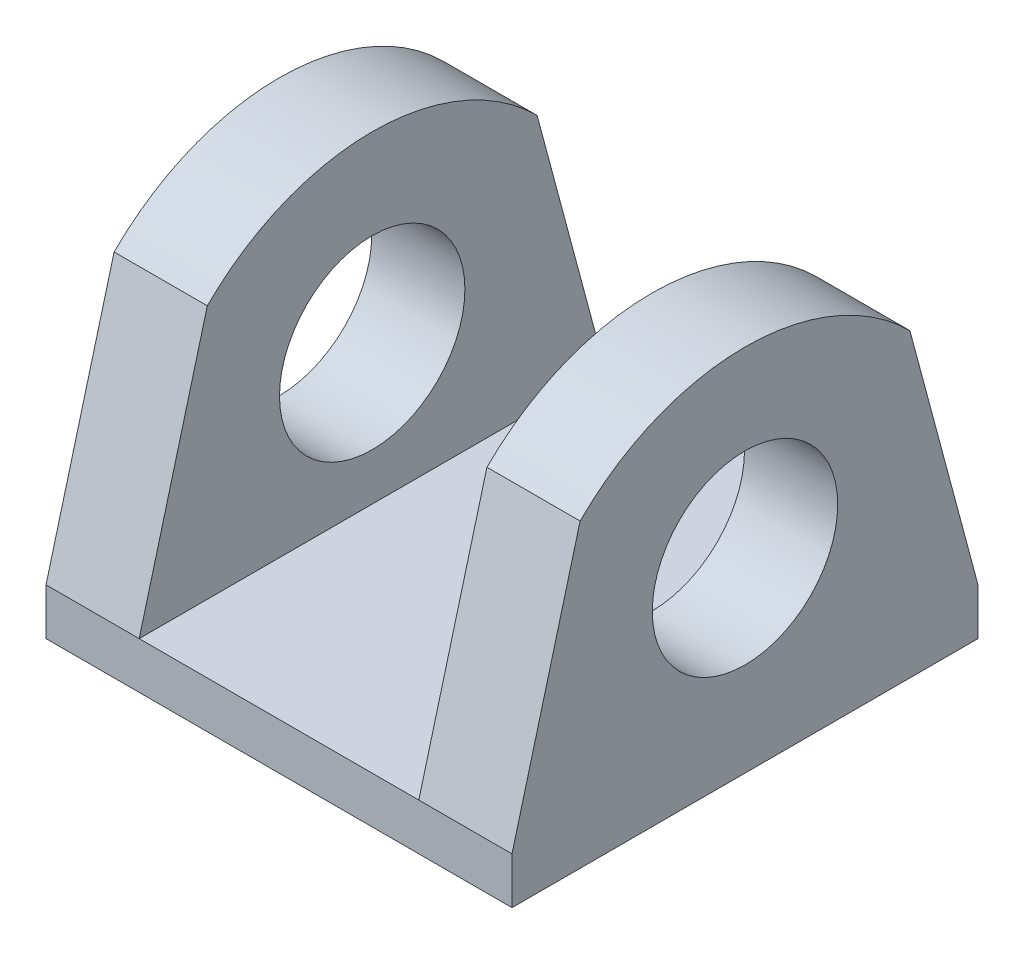
from build123d import *

# Parameters (mm, degrees)
SKETCH1_W           = 25.4
SKETCH1_H           = 25.4
BOSS_EXTRUDE1_DEPTH = 2.54
BOSS_EXTRUDE2_DEPTH = 5.08
SKETCH3_R           = 5.053169443
CUT_EXTRUDE1_DEPTH  = 35.801810995


with BuildPart() as part:
    # Sketch1 → Boss-Extrude1 (new body)
    with BuildSketch(Plane(origin=(0, 0, 0), x_dir=(1, 0, 0), z_dir=(0, 1, 0))):
        Rectangle(SKETCH1_W, SKETCH1_H)
    extrude(amount=BOSS_EXTRUDE1_DEPTH)

    # Sketch2 → Boss-Extrude2 (add)
    with BuildSketch(Plane(origin=(12.7, 0, 0), x_dir=(0, 0, -1), z_dir=(1, 0, 0))):
        with BuildLine():
            Line((-12.7, 2.54), (-8.987628784, 16.394757994))
            ThreePointArc((-8.987628784, 16.394757994), (0, 20.11755573), (8.987628784, 16.394757994))
            Line((8.987628784, 16.394757994), (12.7, 2.54))
            Line((12.7, 2.54), (-12.7, 2.54))
        make_face()
    boss_extrude2 = extrude(amount=-BOSS_EXTRUDE2_DEPTH)

    # Mirror1: Boss-Extrude2 across plane
    add(boss_extrude2.mirror(Plane(origin=(0, 0, 0), x_dir=(0, 0, 1), z_dir=(1, 0, 0))))

    # Sketch3 → Cut-Extrude1 (cut, through all)
    with BuildSketch(Plane(origin=(12.7, 0, 0), x_dir=(0, 0, -1), z_dir=(1, 0, 0))):
        with Locations((0, 10.16)):
            Circle(SKETCH3_R)
    extrude(amount=-CUT_EXTRUDE1_DEPTH, mode=Mode.SUBTRACT)


solid = part.part
